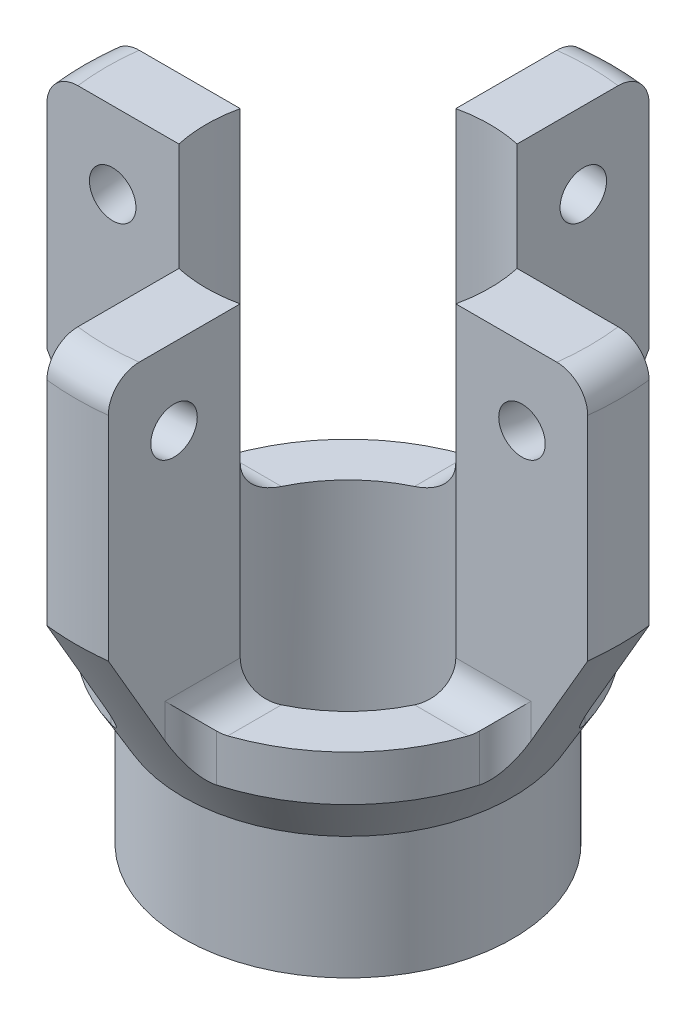
from build123d import *

# Parameters (mm, degrees)
SKETCH_2_R          = 2.9999999999999996
CUT_EXTRUDE_START   = -100
CUT_EXTRUDE_6_DEPTH = 100
CUT_EXTRUDE_START_2 = -44
CUT_EXTRUDE_8_DEPTH = 44
FILLET_2_R          = 4


with BuildPart() as part:
    # 草图2 → 旋转2 (revolve)
    with BuildSketch(Plane.XY):
        with BuildLine():
            Line((21.500000000000004, 6e-17), (18.500000000000007, 0))
            Line((18.500000000000007, 0), (18.500000000000007, 72))
            Line((18.500000000000007, 72), (31.5, 72.00000000000001))
            ThreePointArc((31.5, 72.00000000000001), (34.3284271247462, 70.82842712474618), (35.50000000000001, 67.99999999999999))
            Line((35.50000000000001, 67.99999999999999), (35.50000000000001, 40.24871130596422))
            Line((35.50000000000001, 40.24871130596422), (21.500000000000004, 16))
            Line((21.500000000000004, 16), (21.500000000000004, 6e-17))
        make_face()
        with Locations((27.000000000000004, 61.99999999999999)):
            Circle(SKETCH_2_R, mode=Mode.SUBTRACT)
    revolve(axis=Axis((0, 66.74904508701225, 0), (0, -1, 0)))

    # 草图3 → 切除-拉伸6 (cut)
    with BuildSketch(Plane(origin=(0, 72.00000000000001, 0), x_dir=(1, 0, 0), z_dir=(0, 1, 0)).offset(CUT_EXTRUDE_START)):
        with BuildLine():
            ThreePointArc((4.000000000000002, -35.27392804891455), (25.10229073212231, -25.102290732122565), (35.2739280489145, -4.000000000000363))
            Line((35.2739280489145, -4.000000000000362), (24.67792535850604, -4.000000000000409))
            ThreePointArc((24.677925358506066, -4.00000000000041), (17.67766952966373, -17.677669529663646), (4.000000000000553, -24.67792535850604))
            Line((4.00000000000054, -24.677925358505956), (4.000000000000002, -35.27392804891455))
        make_face()
        with BuildLine():
            Line((-24.677925358506048, -4.0000000000002185), (-35.27392804891456, -3.9999999999998788))
            ThreePointArc((-35.27392804891456, -3.9999999999998788), (-25.102290732122476, -25.102290732122402), (-3.9999999999999956, -35.27392804891454))
            Line((-3.9999999999999947, -35.27392804891454), (-4.000000000000683, -24.67792535850591))
            ThreePointArc((-4.000000000000694, -24.67792535850602), (-17.677669529663856, -17.67766952966352), (-24.677925358506094, -4.000000000000226))
        make_face()
        with BuildLine():
            Line((-4.000000000000524, 24.677925358505934), (-3.9999999999997544, 35.273928048914584))
            ThreePointArc((-3.999999999999755, 35.273928048914584), (-25.102290732122313, 25.102290732122572), (-35.27392804891454, 4.000000000000117))
            Line((-35.27392804891454, 4.000000000000117), (-24.677925358506027, 4.00000000000037))
            ThreePointArc((-24.67792535850607, 4.0000000000003855), (-17.677669529663742, 17.677669529663635), (-4.000000000000539, 24.677925358506045))
        make_face()
        with BuildLine():
            Line((4.000000000000243, 35.27392804891452), (4.000000000000696, 24.677925358505934))
            ThreePointArc((4.000000000000712, 24.677925358506016), (17.677669529663973, 17.677669529663405), (24.677925358506144, 3.999999999999917))
            Line((24.67792535850612, 3.9999999999999125), (35.27392804891459, 3.9999999999996323))
            ThreePointArc((35.27392804891459, 3.9999999999996323), (25.10229073212266, 25.102290732122228), (4.000000000000244, 35.27392804891452))
        make_face()
    extrude(amount=CUT_EXTRUDE_6_DEPTH, mode=Mode.SUBTRACT)

    # 草图3<6> → 切除-拉伸8 (cut)
    with BuildSketch(Plane(origin=(0, 72.00000000000001, 0), x_dir=(1, 0, 0), z_dir=(0, 1, 0)).offset(CUT_EXTRUDE_START_2)):
        with BuildLine():
            Line((4.000000000000002, -18.06239186818845), (4.000000000000002, -24.677925358505956))
            ThreePointArc((4.000000000000553, -24.67792535850604), (17.67766952966373, -17.677669529663646), (24.677925358506066, -4.00000000000041))
            Line((24.67792535850604, -4.000000000000253), (18.062391868188406, -4.000000000000186))
            ThreePointArc((18.062391868188406, -4.000000000000196), (13.08147545195106, -13.081475451951206), (3.999999999999996, -18.062391868188453))
        make_face()
        with BuildLine():
            ThreePointArc((-24.677925358506094, -4.000000000000226), (-17.677669529663856, -17.67766952966352), (-4.000000000000694, -24.67792535850602))
            Line((-3.999999999999994, -24.67792535850591), (-3.9999999999999942, -18.06239186818845))
            ThreePointArc((-4.000000000000003, -18.06239186818845), (-13.08147545195116, -13.081475451951109), (-18.062391868188467, -3.9999999999999334))
            Line((-18.062391868188463, -3.999999999999938), (-24.677925358506048, -3.999999999999915))
        make_face()
        with BuildLine():
            ThreePointArc((-4.000000000000539, 24.677925358506045), (-17.677669529663742, 17.677669529663635), (-24.67792535850607, 4.0000000000003855))
            Line((-24.677925358506027, 4.000000000000082), (-18.062391868188435, 4.0000000000000595))
            ThreePointArc((-18.06239186818844, 4.000000000000066), (-13.081475451951063, 13.081475451951205), (-3.9999999999998743, 18.062391868188477))
            Line((-3.9999999999998743, 18.062391868188477), (-3.999999999999828, 24.677925358505934))
        make_face()
        with BuildLine():
            Line((18.06239186818849, 3.9999999999998126), (24.67792535850612, 3.9999999999997433))
            ThreePointArc((24.677925358506144, 3.999999999999917), (17.677669529663973, 17.677669529663405), (4.000000000000712, 24.677925358506016))
            Line((4.00000000000017, 24.677925358505934), (4.000000000000124, 18.06239186818842))
            ThreePointArc((4.000000000000125, 18.06239186818842), (13.081475451951246, 13.081475451951022), (18.06239186818849, 3.9999999999998126))
        make_face()
    extrude(amount=CUT_EXTRUDE_8_DEPTH, mode=Mode.SUBTRACT)

    # 圆角2
    fillet_2_edges = [part.edges().sort_by_distance(p)[0] for p in [
        (4.000000000000547, 25.031088913245497, 24.677925358506002),
        (4.000000000000002, 28.000000000000014, 21.3701586133472),
        (24.67792535850605, 25.03108891324552, 4.0000000000004095),
        (21.370158613347222, 28.000000000000014, 4.000000000000219),
        (-24.677925358506073, 25.03108891324551, 4.000000000000222),
        (-21.370158613347257, 28.000000000000014, 3.9999999999999263),
        (-4.000000000000688, 25.031088913245483, 24.677925358505966),
        (-3.999999999999994, 28.000000000000014, 21.37015861334718),
        (-24.677925358506048, 25.03108891324551, -4.000000000000378),
        (-21.37015861334723, 28.000000000000014, -4.000000000000071),
        (-4.000000000000531, 25.031088913245483, -24.677925358505988),
        (-3.9999999999998512, 28.000000000000014, -21.370158613347208),
        (4.000000000000703, 25.031088913245497, -24.677925358505973),
        (4.000000000000147, 28.000000000000014, -21.37015861334718),
        (21.370158613347307, 28.000000000000014, -3.999999999999778),
        (24.67792535850613, 25.03108891324551, -3.999999999999913),
    ]]
    fillet(fillet_2_edges, radius=FILLET_2_R)


solid = part.part
